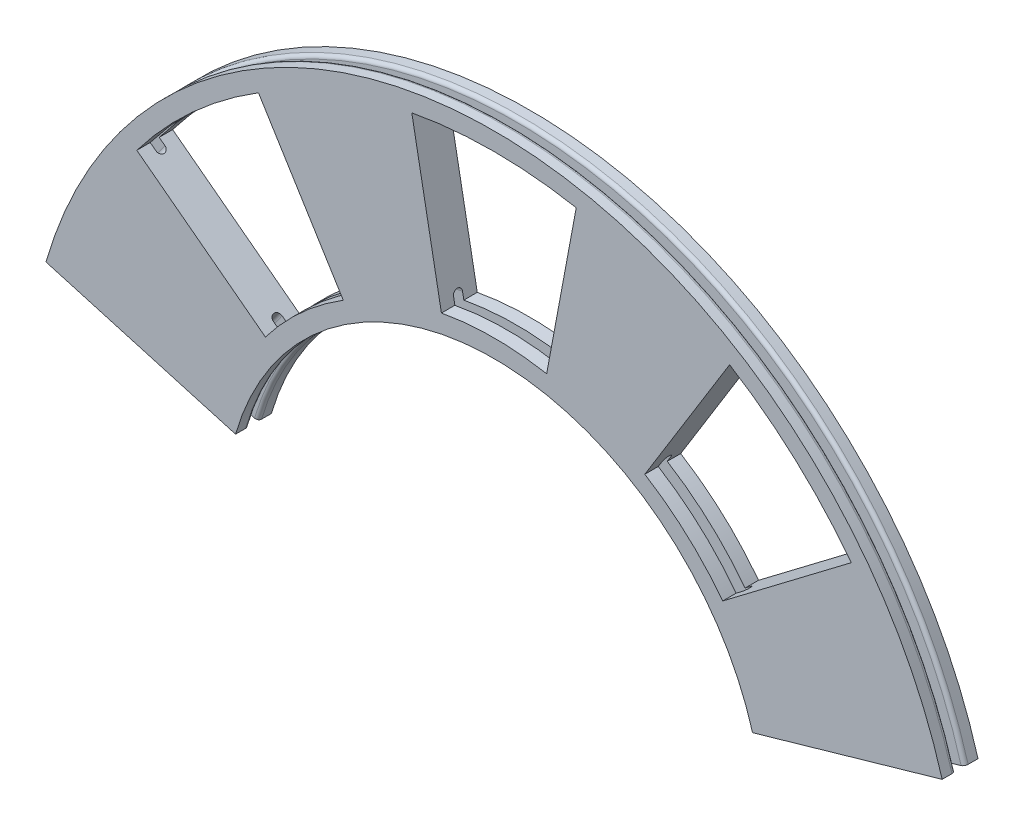
from build123d import *

# Parameters (mm, degrees)
BOSS_EXTRUDE1_DEPTH = 10
FILLET1_R           = 1


with BuildPart() as part:
    # Sketch1 → Boss-Extrude1 (new body)
    with BuildSketch(Plane.XY):
        with BuildLine():
            Line((-120.157711992, 34.454669477), (-76.900935675, 22.050988465))
            ThreePointArc((-76.900935675, 22.050988465), (-71.550192613, 35.785051865), (-63.770600578, 48.304352826))
            Line((-63.770600578, 48.304352826), (-99.641563403, 75.475551291))
            ThreePointArc((-99.641563403, 75.475551291), (-111.797175958, 55.914143539), (-120.157711992, 34.454669477))
        make_face()
        with BuildLine():
            Line((-65.715773705, 106.331731324), (-42.058095171, 68.052308047))
            ThreePointArc((-42.058095171, 68.052308047), (-28.861145484, 74.61256115), (-14.684736898, 78.640692407))
            Line((-14.684736898, 78.640692407), (-22.944901403, 122.876081886))
            ThreePointArc((-22.944901403, 122.876081886), (-45.095539819, 116.582126797), (-65.715773705, 106.331731324))
        make_face()
        with BuildLine():
            ThreePointArc((14.665128742, 78.644351348), (28.842541232, 74.619754859), (42.041126195, 68.062792393))
            Line((42.041126195, 68.062792393), (65.689259679, 106.348113113))
            ThreePointArc((65.689259679, 106.348113113), (45.066470675, 116.593366968), (22.914263659, 122.881798982))
            Line((22.914263659, 122.881798982), (14.665128742, 78.644351348))
        make_face()
        with BuildLine():
            ThreePointArc((63.758554739, 48.320251424), (71.545730865, 35.79397149), (76.900935675, 22.050988465))
            Line((76.900935675, 22.050988465), (120.157711992, 34.454669477))
            ThreePointArc((120.157711992, 34.454669477), (111.790204476, 55.928080454), (99.622741779, 75.500392849))
            Line((99.622741779, 75.500392849), (63.758554739, 48.320251424))
        make_face()
        with BuildLine():
            Line((-76.900935675, 22.050988465), (-72.094627195, 20.672801686))
            ThreePointArc((-72.094627195, 20.672801686), (-67.078305575, 33.548486124), (-59.784938042, 45.285330774))
            Line((-59.784938042, 45.285330774), (-63.770600578, 48.304352826))
            ThreePointArc((-63.770600578, 48.304352826), (-71.550192613, 35.785051865), (-76.900935675, 22.050988465))
        make_face()
        with BuildLine():
            Line((-63.770600578, 48.304352826), (-59.784938042, 45.285330774))
            ThreePointArc((-59.784938042, 45.285330774), (-50.46348928, 55.483657501), (-39.429464223, 63.799038795))
            Line((-39.429464223, 63.799038795), (-42.058095171, 68.052308047))
            ThreePointArc((-42.058095171, 68.052308047), (-53.827721899, 59.182568001), (-63.770600578, 48.304352826))
        make_face()
        with BuildLine():
            Line((-42.058095171, 68.052308047), (-39.429464223, 63.799038795))
            ThreePointArc((-39.429464223, 63.799038795), (-27.057323891, 69.949276078), (-13.766940842, 73.725649131))
            Line((-13.766940842, 73.725649131), (-14.684736898, 78.640692407))
            ThreePointArc((-14.684736898, 78.640692407), (-28.861145484, 74.61256115), (-42.058095171, 68.052308047))
        make_face()
        with BuildLine():
            Line((-14.684736898, 78.640692407), (-13.766940842, 73.725649131))
            ThreePointArc((-13.766940842, 73.725649131), (-0.009349978, 74.999999417), (13.748558195, 73.729079389))
            Line((13.748558195, 73.729079389), (14.665128742, 78.644351348))
            ThreePointArc((14.665128742, 78.644351348), (-0.00997331, 79.999999378), (-14.684736898, 78.640692407))
        make_face()
        with BuildLine():
            ThreePointArc((13.748558195, 73.729079389), (27.039882405, 69.956020181), (39.413555808, 63.808867868))
            Line((39.413555808, 63.808867868), (42.041126195, 68.062792393))
            ThreePointArc((42.041126195, 68.062792393), (28.842541232, 74.619754859), (14.665128742, 78.644351348))
            Line((14.665128742, 78.644351348), (13.748558195, 73.729079389))
        make_face()
        with BuildLine():
            ThreePointArc((39.413555808, 63.808867868), (50.449653819, 55.496237977), (59.773645067, 45.30023571))
            Line((59.773645067, 45.30023571), (63.758554739, 48.320251424))
            ThreePointArc((63.758554739, 48.320251424), (53.812964073, 59.195987175), (42.041126195, 68.062792393))
            Line((42.041126195, 68.062792393), (39.413555808, 63.808867868))
        make_face()
        with BuildLine():
            ThreePointArc((59.773645067, 45.30023571), (67.074122686, 33.556848272), (72.094627195, 20.672801686))
            Line((72.094627195, 20.672801686), (76.900935675, 22.050988465))
            ThreePointArc((76.900935675, 22.050988465), (71.545730865, 35.79397149), (63.758554739, 48.320251424))
            Line((63.758554739, 48.320251424), (59.773645067, 45.30023571))
        make_face()
        with BuildLine():
            ThreePointArc((99.622741779, 75.500392849), (111.790204476, 55.928080454), (120.157711992, 34.454669477))
            Line((120.157711992, 34.454669477), (124.964020472, 35.832856256))
            ThreePointArc((124.964020472, 35.832856256), (116.261812655, 58.165203672), (103.60765145, 78.520408563))
            Line((103.60765145, 78.520408563), (99.622741779, 75.500392849))
        make_face()
        with BuildLine():
            ThreePointArc((65.689259679, 106.348113113), (84.082756365, 92.493729961), (99.622741779, 75.500392849))
            Line((99.622741779, 75.500392849), (103.60765145, 78.520408563))
            ThreePointArc((103.60765145, 78.520408563), (87.446066619, 96.193479159), (68.316830066, 110.602037638))
            Line((68.316830066, 110.602037638), (65.689259679, 106.348113113))
        make_face()
        with BuildLine():
            ThreePointArc((22.914263659, 122.881798982), (45.066470675, 116.593366968), (65.689259679, 106.348113113))
            Line((65.689259679, 106.348113113), (68.316830066, 110.602037638))
            ThreePointArc((68.316830066, 110.602037638), (46.869129502, 121.257101647), (23.830834205, 127.797070941))
            Line((23.830834205, 127.797070941), (22.914263659, 122.881798982))
        make_face()
        with BuildLine():
            Line((-23.86269746, 127.791125161), (-22.944901403, 122.876081886))
            ThreePointArc((-22.944901403, 122.876081886), (-0.015583297, 124.999999029), (22.914263659, 122.881798982))
            Line((22.914263659, 122.881798982), (23.830834205, 127.797070941))
            ThreePointArc((23.830834205, 127.797070941), (-0.016206629, 129.99999899), (-23.86269746, 127.791125161))
        make_face()
        with BuildLine():
            Line((-68.344404653, 110.585000577), (-65.715773705, 106.331731324))
            ThreePointArc((-65.715773705, 106.331731324), (-45.095539819, 116.582126797), (-22.944901403, 122.876081886))
            Line((-22.944901403, 122.876081886), (-23.86269746, 127.791125161))
            ThreePointArc((-23.86269746, 127.791125161), (-46.899361411, 121.245411869), (-68.344404653, 110.585000577))
        make_face()
        with BuildLine():
            Line((-103.627225939, 78.494573342), (-99.641563403, 75.475551291))
            ThreePointArc((-99.641563403, 75.475551291), (-84.105815467, 92.472762501), (-65.715773705, 106.331731324))
            Line((-65.715773705, 106.331731324), (-68.344404653, 110.585000577))
            ThreePointArc((-68.344404653, 110.585000577), (-87.470048086, 96.171673001), (-103.627225939, 78.494573342))
        make_face()
        with BuildLine():
            Line((-124.964020472, 35.832856256), (-120.157711992, 34.454669477))
            ThreePointArc((-120.157711992, 34.454669477), (-111.797175958, 55.914143539), (-99.641563403, 75.475551291))
            Line((-99.641563403, 75.475551291), (-103.627225939, 78.494573342))
            ThreePointArc((-103.627225939, 78.494573342), (-116.269062997, 58.150709281), (-124.964020472, 35.832856256))
        make_face()
    extrude(amount=BOSS_EXTRUDE1_DEPTH)

    # Cut-Sweep1: sweep along a path in Sketch3
    with BuildLine(Plane.XY.offset(10)) as cut_sweep1_path:
        CenterArc((0, 0), 75, 0, 360)
    # Sketch2 → Cut-Sweep1 (sweep, cut)
    with BuildSketch(Plane(origin=(0, 0, 0), x_dir=(0.9612616959383197, 0.2756373558169964, 0), z_dir=(0.27563735581699644, -0.9612616959383198, 0))):
        with BuildLine():
            Line((75, 6.25), (82, 6.25))
            ThreePointArc((82, 6.25), (83.25, 5), (82, 3.75))
            Line((82, 3.75), (75, 3.75))
            ThreePointArc((75, 3.75), (73.75, 5), (75, 6.25))
        make_face()
        with BuildLine():
            Line((123, 6.25), (130, 6.25))
            ThreePointArc((130, 6.25), (131.25, 5), (130, 3.75))
            Line((130, 3.75), (123, 3.75))
            ThreePointArc((123, 3.75), (121.75, 5), (123, 6.25))
        make_face()
    sweep(path=cut_sweep1_path.line, mode=Mode.SUBTRACT)

    # Fillet1
    fillet1_edges = [part.edges().sort_by_distance(p)[0] for p in [
        (0, 130, 6.25),
        (0, 130, 3.75),
        (0, 75, 3.75),
        (0, 75, 6.25),
    ]]
    fillet(fillet1_edges, radius=FILLET1_R)


solid = part.part
